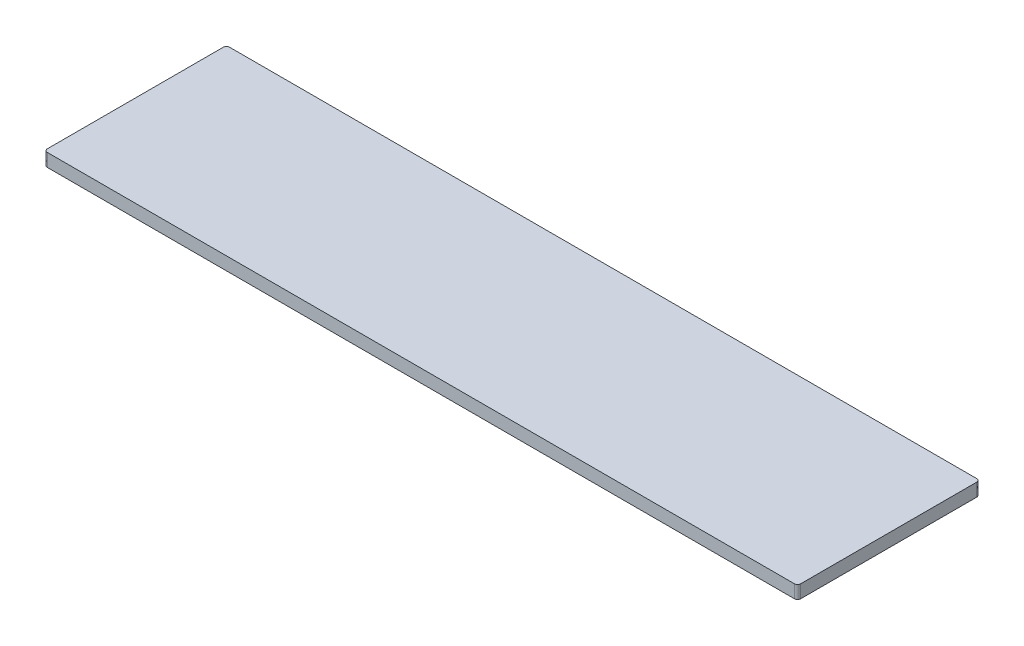
from build123d import *

# Parameters (mm, degrees)
SKETCH1_W           = 735
SKETCH1_H           = 177.8
BOSS_EXTRUDE1_DEPTH = 12.7
FILLET1_R           = 3


with BuildPart() as part:
    # Sketch1 → Boss-Extrude1 (new body)
    with BuildSketch(Plane(origin=(0, 0, 0), x_dir=(1, 0, 0), z_dir=(0, 1, 0))):
        Rectangle(SKETCH1_W, SKETCH1_H)
    extrude(amount=BOSS_EXTRUDE1_DEPTH)

    # Fillet1
    fillet1_edges = [part.edges().sort_by_distance(p)[0] for p in [
        (367.5, 6.35, 88.9),
        (-367.5, 6.35, 88.9),
        (-367.5, 6.35, -88.9),
        (367.5, 6.35, -88.9),
    ]]
    fillet(fillet1_edges, radius=FILLET1_R)


solid = part.part
